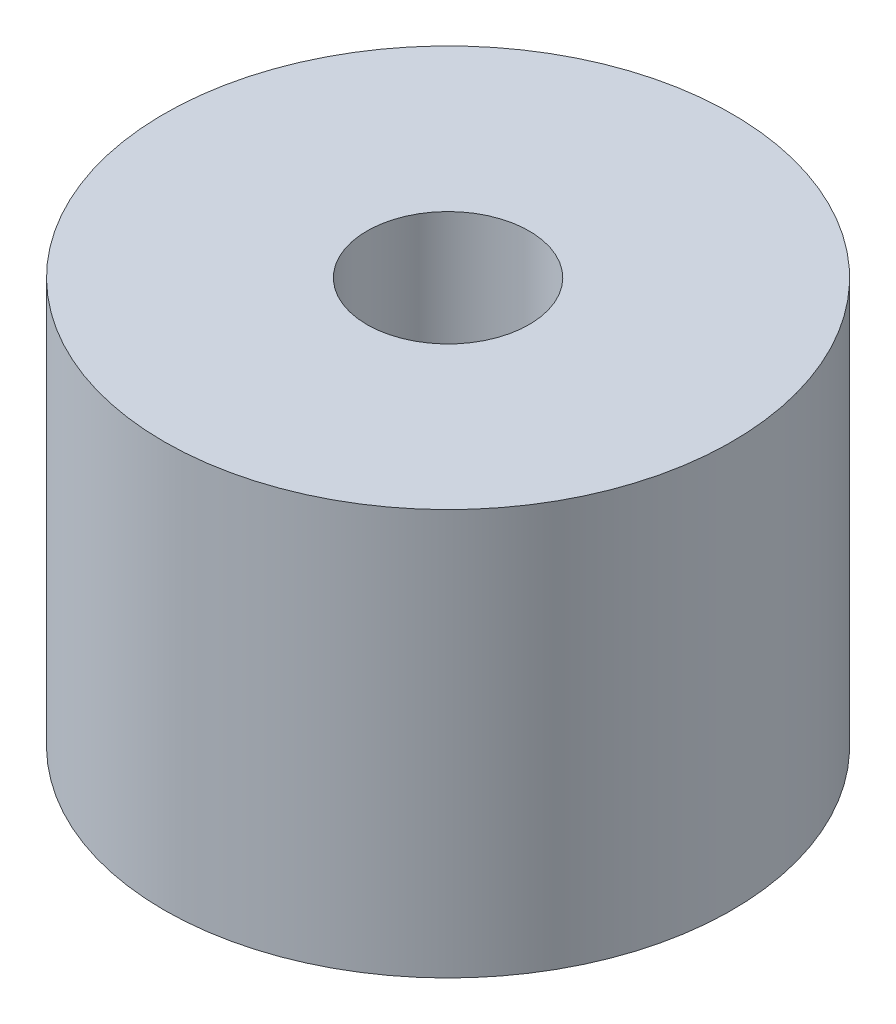
from build123d import *

# Parameters (mm, degrees)
SKETCH1_R           = 3.5
SKETCH1_R_2         = 1
BOSS_EXTRUDE1_DEPTH = 5


with BuildPart() as part:
    # Sketch1 → Boss-Extrude1 (new body)
    with BuildSketch(Plane(origin=(0, 0, 0), x_dir=(1, 0, 0), z_dir=(0, 1, 0))):
        with Locations(Location((0, 0, 0), (0, 0, 270))):
            Circle(SKETCH1_R)
        with Locations(Location((0, 0, 0), (0, 0, 270))):
            Circle(SKETCH1_R_2, mode=Mode.SUBTRACT)
    extrude(amount=BOSS_EXTRUDE1_DEPTH)


solid = part.part
